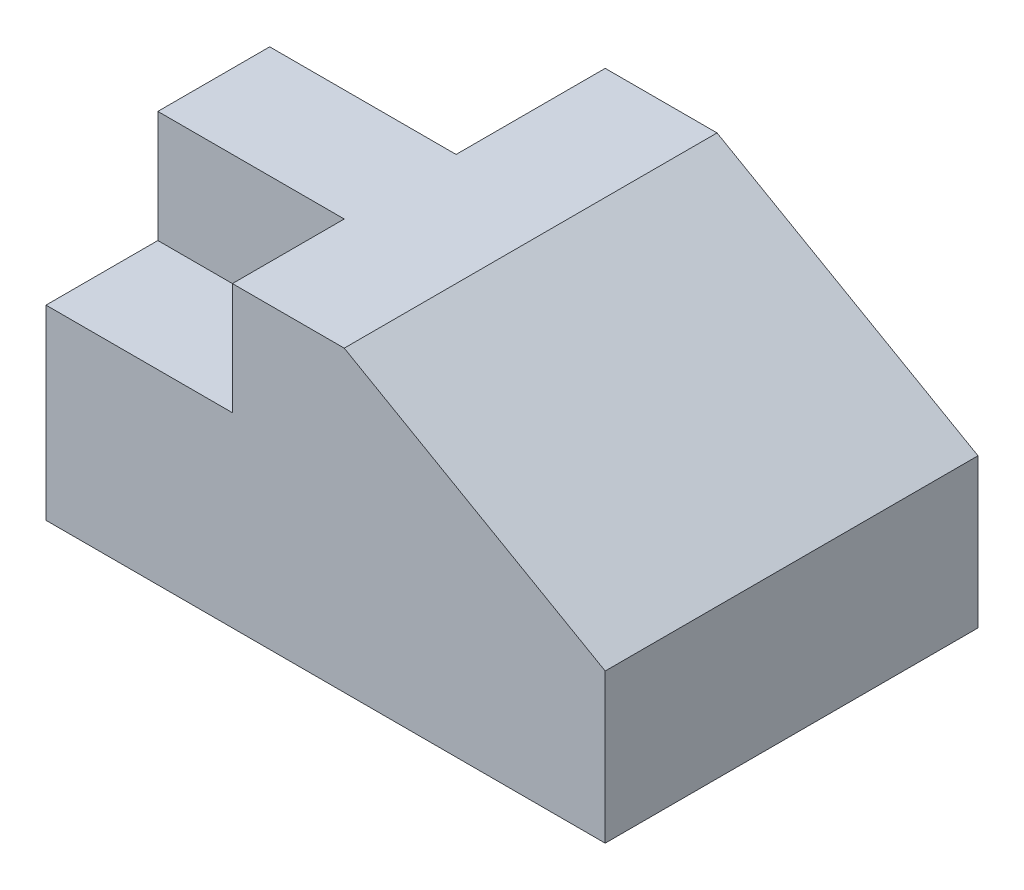
from build123d import *

# Parameters (mm, degrees)
BOSS_EXTRUDE1_DEPTH = 100
SKETCH2_W           = 50
SKETCH2_H           = 30
BOSS_EXTRUDE2_DEPTH = 30
SKETCH4_W           = 50
SKETCH4_H           = 40
CUT_EXTRUDE2_DEPTH  = 188.082869339


with BuildPart() as part:
    # Sketch1 → Boss-Extrude1 (new body)
    with BuildSketch(Plane.XY):
        Polygon((0, 0), (0, 50), (50, 50), (50, 80), (80, 80), (150, 40), (150, 0), align=None)
    extrude(amount=BOSS_EXTRUDE1_DEPTH)

    # Sketch2 → Boss-Extrude2 (add)
    with BuildSketch(Plane(origin=(0, 80, 0), x_dir=(1, 0, 0), z_dir=(0, 1, 0))):
        with Locations((25, -55)):
            Rectangle(SKETCH2_W, SKETCH2_H)
    extrude(amount=-BOSS_EXTRUDE2_DEPTH)

    # Sketch4 → Cut-Extrude2 (cut, through all)
    with BuildSketch(Plane(origin=(0, 50, 0), x_dir=(1, 0, 0), z_dir=(0, 1, 0))):
        with Locations((25, -20)):
            Rectangle(SKETCH4_W, SKETCH4_H)
    extrude(amount=-CUT_EXTRUDE2_DEPTH, mode=Mode.SUBTRACT)


solid = part.part
